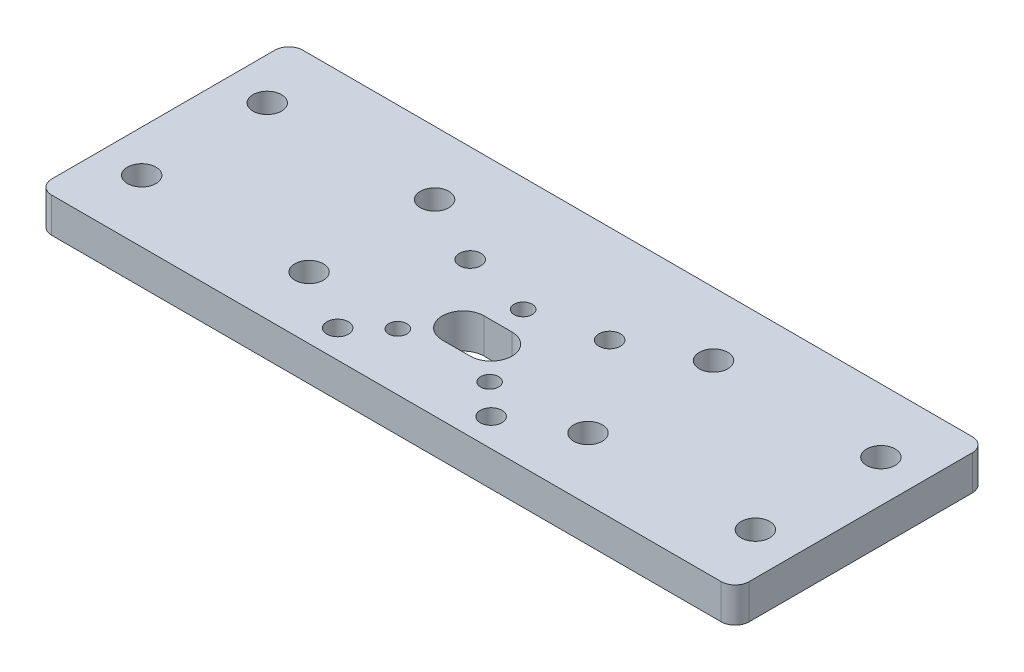
from build123d import *

# Parameters (mm, degrees)
SKETCH1_R           = 1.3
SKETCH1_R_2         = 2.05
SKETCH1_R_3         = 1.55
BOSS_EXTRUDE1_DEPTH = 5


with BuildPart() as part:
    # Sketch1 → Boss-Extrude1 (new body)
    with BuildSketch(Plane(origin=(0, 0, 0), x_dir=(1, 0, 0), z_dir=(0, 1, 0))):
        with BuildLine():
            Line((-48, -12), (48, -12))
            ThreePointArc((48, -12), (49.414213562, -11.414213562), (50, -10))
            Line((50, -10), (50, 22))
            ThreePointArc((50, 22), (49.414213562, 23.414213562), (48, 24))
            Line((48, 24), (-48, 24))
            ThreePointArc((-48, 24), (-49.414213562, 23.414213562), (-50, 22))
            Line((-50, 22), (-50, -10))
            ThreePointArc((-50, -10), (-49.414213562, -11.414213562), (-48, -12))
        make_face()
        with Locations(Location((0, 7.6, 0), (0, 0, 270))):
            Circle(SKETCH1_R, mode=Mode.SUBTRACT)
        with Locations(Location((6.581793069, -3.8, 0), (0, 0, 270))):
            Circle(SKETCH1_R, mode=Mode.SUBTRACT)
        with Locations(Location((-6.581793069, -3.8, 0), (0, 0, 90))):
            Circle(SKETCH1_R, mode=Mode.SUBTRACT)
        with Locations(Location((44, 14.9, 0), (0, 0, 270))):
            Circle(SKETCH1_R_2, mode=Mode.SUBTRACT)
        with Locations(Location((20, 14.9, 0), (0, 0, 270))):
            Circle(SKETCH1_R_2, mode=Mode.SUBTRACT)
        with Locations(Location((44, -3.1, 0), (0, 0, 270))):
            Circle(SKETCH1_R_2, mode=Mode.SUBTRACT)
        with Locations(Location((20, -3.1, 0), (0, 0, 270))):
            Circle(SKETCH1_R_2, mode=Mode.SUBTRACT)
        with Locations(Location((-44, -3.1, 0), (0, 0, 90))):
            Circle(SKETCH1_R_2, mode=Mode.SUBTRACT)
        with Locations(Location((-20, -3.1, 0), (0, 0, 90))):
            Circle(SKETCH1_R_2, mode=Mode.SUBTRACT)
        with Locations(Location((-20, 14.9, 0), (0, 0, 90))):
            Circle(SKETCH1_R_2, mode=Mode.SUBTRACT)
        with Locations(Location((-44, 14.9, 0), (0, 0, 90))):
            Circle(SKETCH1_R_2, mode=Mode.SUBTRACT)
        with Locations(Location((11, -8, 0), (0, 0, 270))):
            Circle(SKETCH1_R_3, mode=Mode.SUBTRACT)
        with Locations(Location((10, 10, 0), (0, 0, 270))):
            Circle(SKETCH1_R_3, mode=Mode.SUBTRACT)
        with Locations(Location((-11, -8, 0), (0, 0, 90))):
            Circle(SKETCH1_R_3, mode=Mode.SUBTRACT)
        with Locations(Location((-10, 10, 0), (0, 0, 90))):
            Circle(SKETCH1_R_3, mode=Mode.SUBTRACT)
        with BuildLine():
            Line((2, 4), (-2, 4))
            ThreePointArc((-2, 4), (-5, 1), (-2, -2))
            Line((-2, -2), (2, -2))
            ThreePointArc((2, -2), (5, 1), (2, 4))
        make_face(mode=Mode.SUBTRACT)
    extrude(amount=BOSS_EXTRUDE1_DEPTH)


solid = part.part
